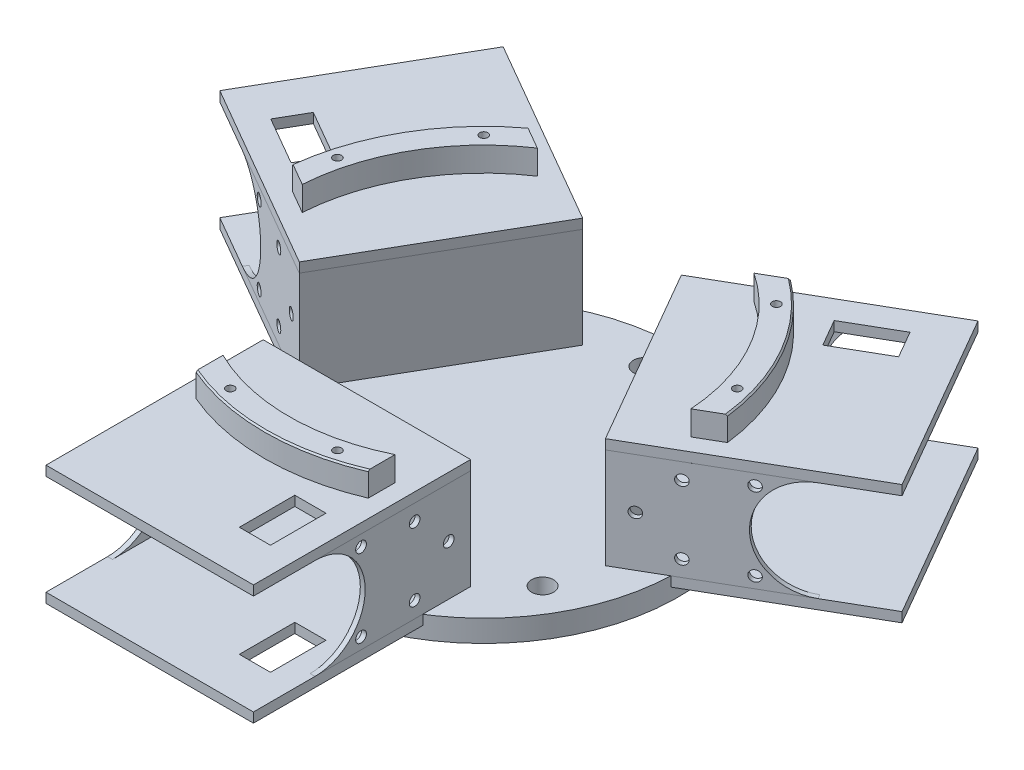
from build123d import *

# Parameters (mm, degrees)
SKETCH_1_R                  = 40
EXTRUDE_1_DEPTH             = 4.5
EXTRUDE_2_DEPTH             = 20.6
EXTRUDE_3_DEPTH             = 2
EXTRUDE_4_DEPTH             = 2
EXTRUDE_START               = 5
EXTRUDE_5_DEPTH             = 5
HOLE_WIZARD_1_AT_2_COUNT    = 2
HOLE_WIZARD_1_AT_2_PITCH    = 21.99961883371431
CHAMFER_1_SIZE              = 0.3
CUT_EXTRUDE_2_DEPTH         = 84.90691270688012
HOLE_WIZARD_2_AT_2_COUNT    = 2
HOLE_WIZARD_2_AT_2_PITCH    = 16
HOLE_WIZARD_2_AT_3_COUNT    = 2
HOLE_WIZARD_2_AT_3_PITCH    = 18.60107523773827
HOLE_WIZARD_2_AT_4_COUNT    = 2
HOLE_WIZARD_2_AT_4_PITCH    = 19.69771560359221
HOLE_WIZARD_2_AT_5_COUNT    = 2
HOLE_WIZARD_2_AT_5_PITCH    = 11.045361017187256
CUT_EXTRUDE_3_DEPTH         = 97.0489979125238
PATTERN_CIRCULAR_1_COUNT    = 3
HOLE_WIZARD_M4_1_AT_2_COUNT = 2
HOLE_WIZARD_M4_1_AT_2_PITCH = 57.15767664977279
HOLE_WIZARD_M4_1_AT_3_COUNT = 2
HOLE_WIZARD_M4_1_AT_3_PITCH = 57.157676649773016


with BuildPart() as part:
    # 草图1 → 凸台-拉伸1 (new body)
    with BuildSketch(Plane(origin=(0, 0, 0), x_dir=(1, 0, 0), z_dir=(0, 1, 0))):
        with Locations(Location((0, 0, 0), (0, 0, 270))):
            Circle(SKETCH_1_R)
    extrude(amount=-EXTRUDE_1_DEPTH)

    # 草图25 → M4 间隙孔1 (revolve, cut)
    with BuildSketch(Plane(origin=(28.578838324886284, -4.5, 16.50000000000032), x_dir=(0, 0, -1), z_dir=(1, 0, 0))):
        Polygon((0, 0), (-1.1e-15, 4.5), (2.2499999999999996, 4.5), (2.25, 0.02500000000000072), (2.275, 0), align=None)
    hole_wizard_m4_1 = revolve(axis=Axis((28.578838324886284, -10.84999999999999, 16.50000000000032), (0, 1, 0)), mode=Mode.SUBTRACT)

    # M4 间隙孔1 at 2: M4 间隙孔1 ×2
    with Locations(*[(-i * HOLE_WIZARD_M4_1_AT_2_PITCH, 0, 0) for i in range(1, HOLE_WIZARD_M4_1_AT_2_COUNT)]):
        add(hole_wizard_m4_1, mode=Mode.SUBTRACT)

    # M4 间隙孔1 at 3: M4 间隙孔1 ×2
    with Locations(*[Vector(-0.49999999999999223, 0, -0.8660254037844431) * (i * HOLE_WIZARD_M4_1_AT_3_PITCH) for i in range(1, HOLE_WIZARD_M4_1_AT_3_COUNT)]):
        add(hole_wizard_m4_1, mode=Mode.SUBTRACT)


with BuildPart() as body_2:
    # 草图2 → 凸台-拉伸2 (new body)
    with BuildSketch(Plane(origin=(0, 0, 0), x_dir=(1, 0, 0), z_dir=(0, 1, 0))):
        Polygon((-21.3, -26.000000000000004), (-21.3, -24), (21.300000000000008, -24), (21.300000000000015, -68.60000000000001), (-21.300000000000004, -68.60000000000001), (-21.3, -66.20000000000002), align=None)
        Polygon((-20.299999999999997, -26.000000000000004), (20.300000000000008, -26.000000000000004), (20.30000000000001, -66.60000000000001), (-20.299999999999986, -66.60000000000001), align=None, mode=Mode.SUBTRACT)
    extrude(amount=EXTRUDE_2_DEPTH)

    # 草图18 → 孔2 (revolve, cut)
    with BuildSketch(Plane(origin=(21.30000000000001, 18.3, 46.5), x_dir=(-1.6e-16, 0, -1), z_dir=(0, 1, 0))):
        Polygon((0, 0), (0, 61.300000000000004), (1.1000000000000059, 61.300000000000004), (1.1000000000000136, 4e-17), align=None)
    hole_wizard_2 = revolve(axis=Axis((-88.69999999999999, 18.3, 46.500000000000014), (1, 0, -1.2e-16)), mode=Mode.SUBTRACT)

    # 孔2 at 2: 孔2 ×2
    with Locations(*[(0, -i * HOLE_WIZARD_2_AT_2_PITCH, 0) for i in range(1, HOLE_WIZARD_2_AT_2_COUNT)]):
        add(hole_wizard_2, mode=Mode.SUBTRACT)

    # 孔2 at 3: 孔2 ×2
    with Locations(*[Vector(0, -0.8064049958557057, -0.5913636636275172) * (i * HOLE_WIZARD_2_AT_3_PITCH) for i in range(1, HOLE_WIZARD_2_AT_3_COUNT)]):
        add(hole_wizard_2, mode=Mode.SUBTRACT)

    # 孔2 at 4: 孔2 ×2
    with Locations(*[Vector(0, -0.40613846605344756, -0.9138115486202573) * (i * HOLE_WIZARD_2_AT_4_PITCH) for i in range(1, HOLE_WIZARD_2_AT_4_COUNT)]):
        add(hole_wizard_2, mode=Mode.SUBTRACT)

    # 孔2 at 5: 孔2 ×2
    with Locations(*[Vector(0, -0.09053574604251857, -0.9958932064677039) * (i * HOLE_WIZARD_2_AT_5_PITCH) for i in range(1, HOLE_WIZARD_2_AT_5_COUNT)]):
        add(hole_wizard_2, mode=Mode.SUBTRACT)

    # 草图28 → 切除-拉伸3 (cut, through all)
    with BuildSketch(Plane(origin=(21.300000000000004, 0, -3.31e-15), x_dir=(-1.6e-16, 0, -1), z_dir=(1, 0, -1.6e-16))):
        with BuildLine():
            Line((-68.60000000000001, 20.6), (-68.60000000000001, 0))
            Line((-68.60000000000001, 0), (-55.95, 0))
            ThreePointArc((-55.95, 0), (-45.650000000000006, 10.299999999999997), (-55.95, 20.599999999999994))
            Line((-55.95, 20.6), (-68.60000000000001, 20.6))
        make_face()
    extrude(amount=-CUT_EXTRUDE_3_DEPTH, mode=Mode.SUBTRACT)


with BuildPart() as body_3:
    # 草图3 → 凸台-拉伸3 (new body)
    with BuildSketch(Plane(origin=(0, 20.6, 0), x_dir=(1, 0, 0), z_dir=(0, 1, 0))):
        Polygon((-21.300000000000004, -68.60000000000001), (-21.3, -24), (21.300000000000008, -24), (21.300000000000015, -68.60000000000001), align=None)
    extrude(amount=EXTRUDE_3_DEPTH)

    # 草图6 → 凸台-拉伸5 (add)
    with BuildSketch(Plane(origin=(0, 22.6, 0), x_dir=(1, 0, 0), z_dir=(0, 1, 0)).offset(EXTRUDE_START)):
        with BuildLine():
            ThreePointArc((17.66830226588502, -35.88636363636364), (9.070431482168539, -38.958019363505734), (-1.49747e-12, -40.000000000000036))
            Line((0, -40.00000000000003), (0, -45.000000000000036))
            ThreePointArc((1.5028e-12, -45.00000000000004), (9.017029343516166, -44.08733584396057), (17.66830226588503, -41.386363636363626))
            Line((17.66830226588502, -41.38636363636363), (17.66830226588502, -35.88636363636363))
        make_face()
        with BuildLine():
            Line((0, -45.000000000000036), (0, -40.00000000000003))
            ThreePointArc((-1.49747e-12, -40.000000000000036), (-9.07043148217, -38.95801936350541), (-17.66830226588503, -35.886363636363676))
            Line((-17.66830226588503, -35.88636363636367), (-17.668302265885032, -41.38636363636367))
            ThreePointArc((-17.668302265885032, -41.38636363636367), (-9.017029343514697, -44.08733584396089), (1.5028e-12, -45.00000000000004))
        make_face()
    extrude(amount=-EXTRUDE_5_DEPTH)

    # 草图9 → 孔1 (revolve, cut)
    with BuildSketch(Plane(origin=(-10.99980941685715, 27.6, 41.0518476172854), x_dir=(0, 0, 1), z_dir=(1, 0, 0))):
        Polygon((0, 0), (0, 100), (0.8500000000000012, 100), (0.8500000000000134, 1e-17), align=None)
    hole_wizard_1 = revolve(axis=Axis((-10.99980941685715, -82.4, 41.0518476172854), (0, 1, 0)), mode=Mode.SUBTRACT)

    # 孔1 at 2: 孔1 ×2
    with Locations(*[(i * HOLE_WIZARD_1_AT_2_PITCH, 0, 0) for i in range(1, HOLE_WIZARD_1_AT_2_COUNT)]):
        add(hole_wizard_1, mode=Mode.SUBTRACT)

    # 倒角1
    chamfer_1_edges = [body_3.edges().sort_by_distance(p)[0] for p in [
        (-2.22e-15, 27.6, 45.00000000000003),
    ]]
    chamfer(chamfer_1_edges, length=CHAMFER_1_SIZE)


with BuildPart() as body_4:
    # 草图4 → 凸台-拉伸4 (new body)
    with BuildSketch(Plane(origin=(0, 0, 0), x_dir=(1, 0, 0), z_dir=(0, 1, 0))):
        Polygon((21.300000000000008, -24), (-21.3, -24), (-21.300000000000004, -68.60000000000001), (21.300000000000015, -68.60000000000001), align=None)
    extrude(amount=-EXTRUDE_4_DEPTH)


with BuildPart() as cut_extrude_2_tool:
    # 草图19 → 切除-拉伸2 (new, through all)
    with BuildSketch(Plane(origin=(0, 22.6, 0), x_dir=(1, 0, 0), z_dir=(0, 1, 0))):
        Polygon((16.000000000000014, -48.400000000000006), (16.000000000000014, -59.800000000000004), (9.600000000000012, -59.800000000000004), (9.60000000000001, -48.400000000000006), align=None)
    extrude(amount=-CUT_EXTRUDE_2_DEPTH)


with BuildPart() as body_3_1:
    add(body_3.part)

    # 切除-拉伸2: cut by cut_extrude_2_tool
    add(cut_extrude_2_tool.part, mode=Mode.SUBTRACT)


with BuildPart() as body_4_1:
    add(body_4.part)

    # 切除-拉伸2: cut by cut_extrude_2_tool
    add(cut_extrude_2_tool.part, mode=Mode.SUBTRACT)


with BuildPart() as pattern_circular_1_1:
    # 阵列(圆周)1: pattern copy
    add(body_4_1.part.rotate(Axis((5.1e-16, 0, -2.67e-15), (0, 1, 0)), 1 * 360 / PATTERN_CIRCULAR_1_COUNT))


with BuildPart() as pattern_circular_1_2:
    # 阵列(圆周)1: pattern copy
    add(body_4_1.part.rotate(Axis((5.1e-16, 0, -2.67e-15), (0, 1, 0)), 2 * 360 / PATTERN_CIRCULAR_1_COUNT))


with BuildPart() as pattern_circular_1_3:
    # 阵列(圆周)1: pattern copy
    add(body_2.part.rotate(Axis((5.1e-16, 0, -2.67e-15), (0, 1, 0)), 1 * 360 / PATTERN_CIRCULAR_1_COUNT))


with BuildPart() as pattern_circular_1_4:
    # 阵列(圆周)1: pattern copy
    add(body_2.part.rotate(Axis((5.1e-16, 0, -2.67e-15), (0, 1, 0)), 2 * 360 / PATTERN_CIRCULAR_1_COUNT))


with BuildPart() as pattern_circular_1_5:
    # 阵列(圆周)1: pattern copy
    add(body_3_1.part.rotate(Axis((5.1e-16, 0, -2.67e-15), (0, 1, 0)), 1 * 360 / PATTERN_CIRCULAR_1_COUNT))


with BuildPart() as pattern_circular_1_6:
    # 阵列(圆周)1: pattern copy
    add(body_3_1.part.rotate(Axis((5.1e-16, 0, -2.67e-15), (0, 1, 0)), 2 * 360 / PATTERN_CIRCULAR_1_COUNT))


solid = Compound([part.part, body_2.part, body_3_1.part, body_4_1.part, pattern_circular_1_1.part, pattern_circular_1_2.part, pattern_circular_1_3.part, pattern_circular_1_4.part, pattern_circular_1_5.part, pattern_circular_1_6.part])
